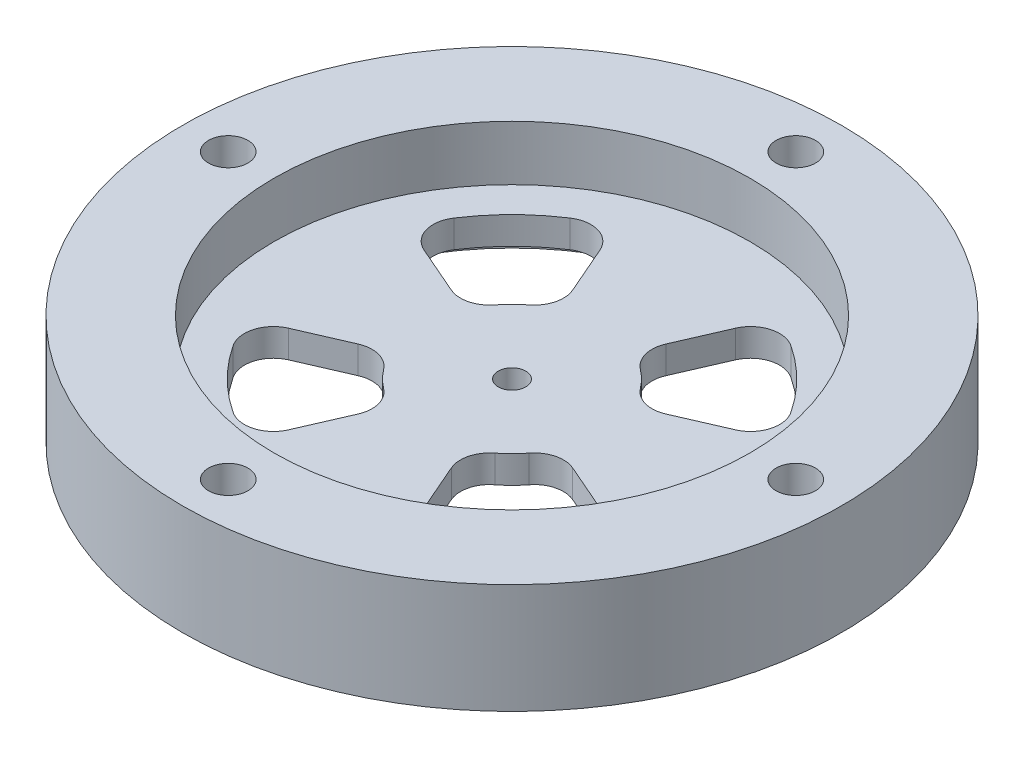
from build123d import *

# Parameters (mm, degrees)
CUT_EXTRUDE1_REACH               = 53.264
F_18_0_1695_DIAMETER_HOLE1_D     = 4.3053
F_18_0_1695_DIAMETER_HOLE1_DEPTH = 381
F_18_0_1695_DIAMETER_HOLE1_TIP   = 1.293442612
CUT_EXTRUDE2_REACH               = 53.264
SKETCH5_R                        = 1.5


with BuildPart() as part:
    # Sketch1 → Revolve1 (revolve)
    with BuildSketch(Plane.XY):
        Polygon((0, 3), (26, 3), (26, 0), (36, 0), (36, 12), (26, 12), (26, 6), (0, 6), align=None)
    revolve(axis=Axis((0, 0, 0), (0, 1, 0)))

    # Sketch2 → Cut-Extrude1 (cut, up to next)
    with BuildSketch(Plane(origin=(0, 6, 0), x_dir=(1, 0, 0), z_dir=(0, 1, 0)), mode=Mode.PRIVATE) as cut_extrude1_sk1:
        with BuildLine():
            Line((7.398917645, 17.016345603), (5.098689446, 11.726182923))
            ThreePointArc((5.098689446, 11.726182923), (4.936869827, 9.663717077), (6.079965983, 7.939396303))
            ThreePointArc((6.079965983, 7.939396303), (7.071067812, 7.071067812), (7.939396303, 6.079965983))
            ThreePointArc((7.939396303, 6.079965983), (9.663717077, 4.936869827), (11.726182923, 5.098689446))
            Line((11.726182923, 5.098689446), (17.016345603, 7.398917645))
            ThreePointArc((17.016345603, 7.398917645), (18.792276888, 9.401129193), (18.406745328, 12.049552955))
            ThreePointArc((18.406745328, 12.049552955), (15.556349186, 15.556349186), (12.049552955, 18.406745328))
            ThreePointArc((12.049552955, 18.406745328), (9.401129193, 18.792276888), (7.398917645, 17.016345603))
        make_face()
    cut_extrude1_tool1 = extrude(cut_extrude1_sk1.sketch, amount=-CUT_EXTRUDE1_REACH, mode=Mode.PRIVATE) & part.part
    # Sketch2 → Cut-Extrude1 (cut, up to next)
    with BuildSketch(Plane(origin=(0, 6, 0), x_dir=(1, 0, 0), z_dir=(0, 1, 0)), mode=Mode.PRIVATE) as cut_extrude1_sk2:
        with BuildLine():
            Line((-7.398917645, 17.016345603), (-5.098689446, 11.726182923))
            ThreePointArc((-5.098689446, 11.726182923), (-4.936869827, 9.663717077), (-6.079965983, 7.939396303))
            ThreePointArc((-6.079965983, 7.939396303), (-7.071067812, 7.071067812), (-7.939396303, 6.079965983))
            ThreePointArc((-7.939396303, 6.079965983), (-9.663717077, 4.936869827), (-11.726182923, 5.098689446))
            Line((-11.726182923, 5.098689446), (-17.016345603, 7.398917645))
            ThreePointArc((-17.016345603, 7.398917645), (-18.792276888, 9.401129193), (-18.406745328, 12.049552955))
            ThreePointArc((-18.406745328, 12.049552955), (-15.556349186, 15.556349186), (-12.049552955, 18.406745328))
            ThreePointArc((-12.049552955, 18.406745328), (-9.401129193, 18.792276888), (-7.398917645, 17.016345603))
        make_face()
    cut_extrude1_tool2 = extrude(cut_extrude1_sk2.sketch, amount=-CUT_EXTRUDE1_REACH, mode=Mode.PRIVATE) & part.part
    # Sketch2 → Cut-Extrude1 (cut, up to next)
    with BuildSketch(Plane(origin=(0, 6, 0), x_dir=(1, 0, 0), z_dir=(0, 1, 0)), mode=Mode.PRIVATE) as cut_extrude1_sk3:
        with BuildLine():
            Line((17.016345603, -7.398917645), (11.726182923, -5.098689446))
            ThreePointArc((11.726182923, -5.098689446), (9.663717077, -4.936869827), (7.939396303, -6.079965983))
            ThreePointArc((7.939396303, -6.079965983), (7.071067812, -7.071067812), (6.079965983, -7.939396303))
            ThreePointArc((6.079965983, -7.939396303), (4.936869827, -9.663717077), (5.098689446, -11.726182923))
            Line((5.098689446, -11.726182923), (7.398917645, -17.016345603))
            ThreePointArc((7.398917645, -17.016345603), (9.401129193, -18.792276888), (12.049552955, -18.406745328))
            ThreePointArc((12.049552955, -18.406745328), (15.556349186, -15.556349186), (18.406745328, -12.049552955))
            ThreePointArc((18.406745328, -12.049552955), (18.792276888, -9.401129193), (17.016345603, -7.398917645))
        make_face()
    cut_extrude1_tool3 = extrude(cut_extrude1_sk3.sketch, amount=-CUT_EXTRUDE1_REACH, mode=Mode.PRIVATE) & part.part
    # Sketch2 → Cut-Extrude1 (cut, up to next)
    with BuildSketch(Plane(origin=(0, 6, 0), x_dir=(1, 0, 0), z_dir=(0, 1, 0)), mode=Mode.PRIVATE) as cut_extrude1_sk4:
        with BuildLine():
            Line((-7.398917645, -17.016345603), (-5.098689446, -11.726182923))
            ThreePointArc((-5.098689446, -11.726182923), (-4.936869827, -9.663717077), (-6.079965983, -7.939396303))
            ThreePointArc((-6.079965983, -7.939396303), (-7.071067812, -7.071067812), (-7.939396303, -6.079965983))
            ThreePointArc((-7.939396303, -6.079965983), (-9.663717077, -4.936869827), (-11.726182923, -5.098689446))
            Line((-11.726182923, -5.098689446), (-17.016345603, -7.398917645))
            ThreePointArc((-17.016345603, -7.398917645), (-18.792276888, -9.401129193), (-18.406745328, -12.049552955))
            ThreePointArc((-18.406745328, -12.049552955), (-15.556349186, -15.556349186), (-12.049552955, -18.406745328))
            ThreePointArc((-12.049552955, -18.406745328), (-9.401129193, -18.792276888), (-7.398917645, -17.016345603))
        make_face()
    cut_extrude1_tool4 = extrude(cut_extrude1_sk4.sketch, amount=-CUT_EXTRUDE1_REACH, mode=Mode.PRIVATE) & part.part
    add(cut_extrude1_tool1.solids().sort_by_distance((11.555905, 6, -11.555905))[0], mode=Mode.SUBTRACT)
    add(cut_extrude1_tool2.solids().sort_by_distance((-11.555905, 6, -11.555905))[0], mode=Mode.SUBTRACT)
    add(cut_extrude1_tool3.solids().sort_by_distance((11.555905, 6, 11.555905))[0], mode=Mode.SUBTRACT)
    add(cut_extrude1_tool4.solids().sort_by_distance((-11.555905, 6, 11.555905))[0], mode=Mode.SUBTRACT)

    # #18 (0.1695) Diameter Hole1
    with Locations(Plane(origin=(0, 12, 0), x_dir=(1, 0, 0), z_dir=(0, 1, 0))):
        with Locations((0, 31), (0, -31), (-31, 0), (31, 0)):
            Hole(F_18_0_1695_DIAMETER_HOLE1_D / 2, depth=F_18_0_1695_DIAMETER_HOLE1_DEPTH)
            with Locations((0, 0, -(F_18_0_1695_DIAMETER_HOLE1_DEPTH + F_18_0_1695_DIAMETER_HOLE1_TIP / 2))):  # 118° drill point
                Cone(0, F_18_0_1695_DIAMETER_HOLE1_D / 2, F_18_0_1695_DIAMETER_HOLE1_TIP, mode=Mode.SUBTRACT)

    # Sketch5 → Cut-Extrude2 (cut, up to next)
    with BuildSketch(Plane(origin=(0, 6, 0), x_dir=(1, 0, 0), z_dir=(0, 1, 0)), mode=Mode.PRIVATE) as cut_extrude2_sk1:
        Circle(SKETCH5_R)
    cut_extrude2_tool1 = extrude(cut_extrude2_sk1.sketch, amount=-CUT_EXTRUDE2_REACH, mode=Mode.PRIVATE) & part.part
    add(cut_extrude2_tool1.solids().sort_by_distance((0, 6, 0))[0], mode=Mode.SUBTRACT)


solid = part.part
